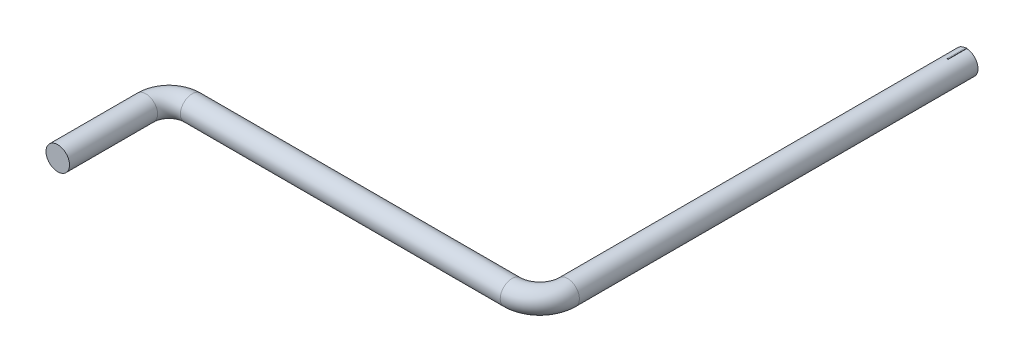
from build123d import *

# Parameters (mm, degrees)
CROQUIS1_R              = 12.7
SALIENTE_EXTRUIR1_DEPTH = 10
CROQUIS2_R              = 12.7
CROQUIS3_W              = 1.11169581
CROQUIS3_H              = 0.66183921
SALIENTE_EXTRUIR2_DEPTH = 20


with BuildPart() as part:
    # Croquis1 → Saliente-Extruir1 (new body)
    with BuildSketch(Plane.XY):
        Circle(CROQUIS1_R)
    extrude(amount=SALIENTE_EXTRUIR1_DEPTH)

    # Barrer1: sweep along a curve in space
    with BuildLine() as barrer1_path:
        Line((0, 0, 10), (0, 0, 430))
        ThreePointArc((0, 0, 430), (-8.786796564, 0, 451.213203436), (-30, 0, 460))
        Line((-30, 0, 460), (-375, 0, 460))
        ThreePointArc((-375, 0, 460), (-392.67766953, 0, 467.32233047), (-400, 0, 485))
        Line((-400, 0, 485), (-400, 0, 580))
    # Croquis2 → Barrer1 (sweep)
    with BuildSketch(Plane.XY.offset(10)):
        Circle(CROQUIS2_R)
    sweep(path=barrer1_path.line)

    # Croquis3 → Saliente-Extruir2 (add)
    with BuildSketch(Plane(origin=(0, 0, 0), x_dir=(-1, 0, 0), z_dir=(0, 0, -1))):
        with Locations((0, 12.7)):
            Rectangle(CROQUIS3_W, CROQUIS3_H)
    extrude(amount=-SALIENTE_EXTRUIR2_DEPTH)


solid = part.part
